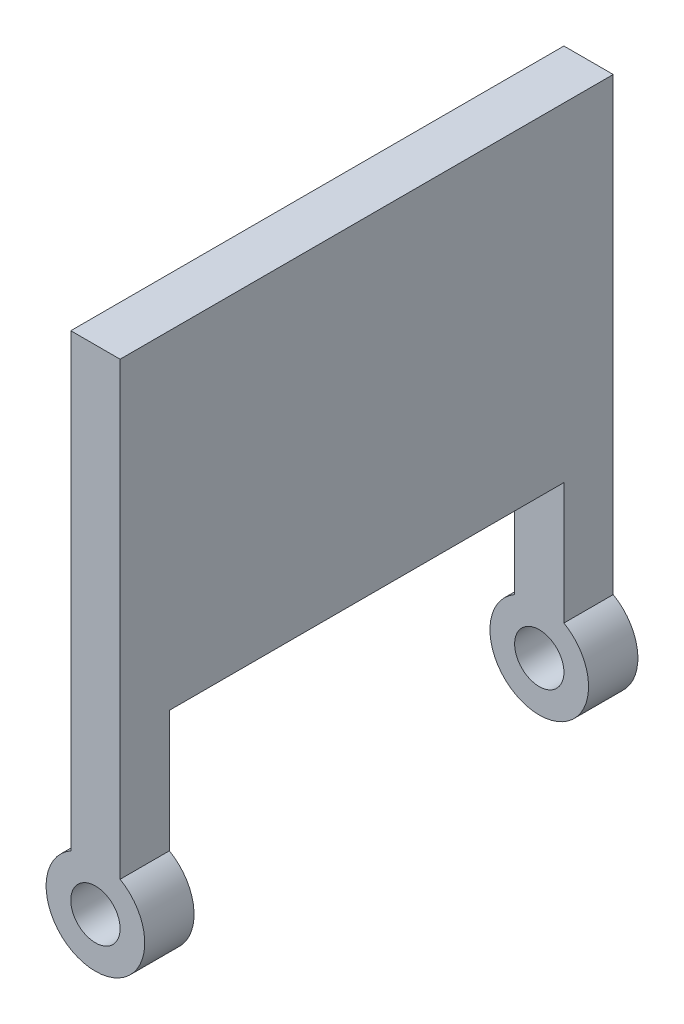
from build123d import *

# Parameters (mm, degrees)
CROQUIS1_R              = 3
SALIENTE_EXTRUIR1_DEPTH = 6
CROQUIS2_W              = 6
CROQUIS2_H              = 40
SALIENTE_EXTRUIR2_DEPTH = 48
CROQUIS3_R              = 3
SALIENTE_EXTRUIR3_DEPTH = 6


with BuildPart() as part:
    # Croquis1 → Saliente-Extruir1 (new body)
    with BuildSketch(Plane.XY):
        with BuildLine():
            Line((3, 60), (-3, 60))
            Line((-3, 60), (-3, 5.196152423))
            ThreePointArc((-3, 5.196152423), (0, -6), (3, 5.196152423))
            Line((3, 5.196152423), (3, 60))
        make_face()
        Circle(CROQUIS1_R, mode=Mode.SUBTRACT)
    extrude(amount=SALIENTE_EXTRUIR1_DEPTH)

    # Croquis2 → Saliente-Extruir2 (add)
    with BuildSketch(Plane.XY.offset(6)):
        with Locations((0, 40)):
            Rectangle(CROQUIS2_W, CROQUIS2_H)
    extrude(amount=SALIENTE_EXTRUIR2_DEPTH)

    # Croquis3 → Saliente-Extruir3 (add)
    with BuildSketch(Plane.XY.offset(54)):
        with BuildLine():
            Line((-3, 5.196152423), (-3, 60))
            Line((-3, 60), (3, 60))
            Line((3, 60), (3, 5.196152423))
            ThreePointArc((3, 5.196152423), (0, -6), (-3, 5.196152423))
        make_face()
        Circle(CROQUIS3_R, mode=Mode.SUBTRACT)
    extrude(amount=SALIENTE_EXTRUIR3_DEPTH)


solid = part.part
